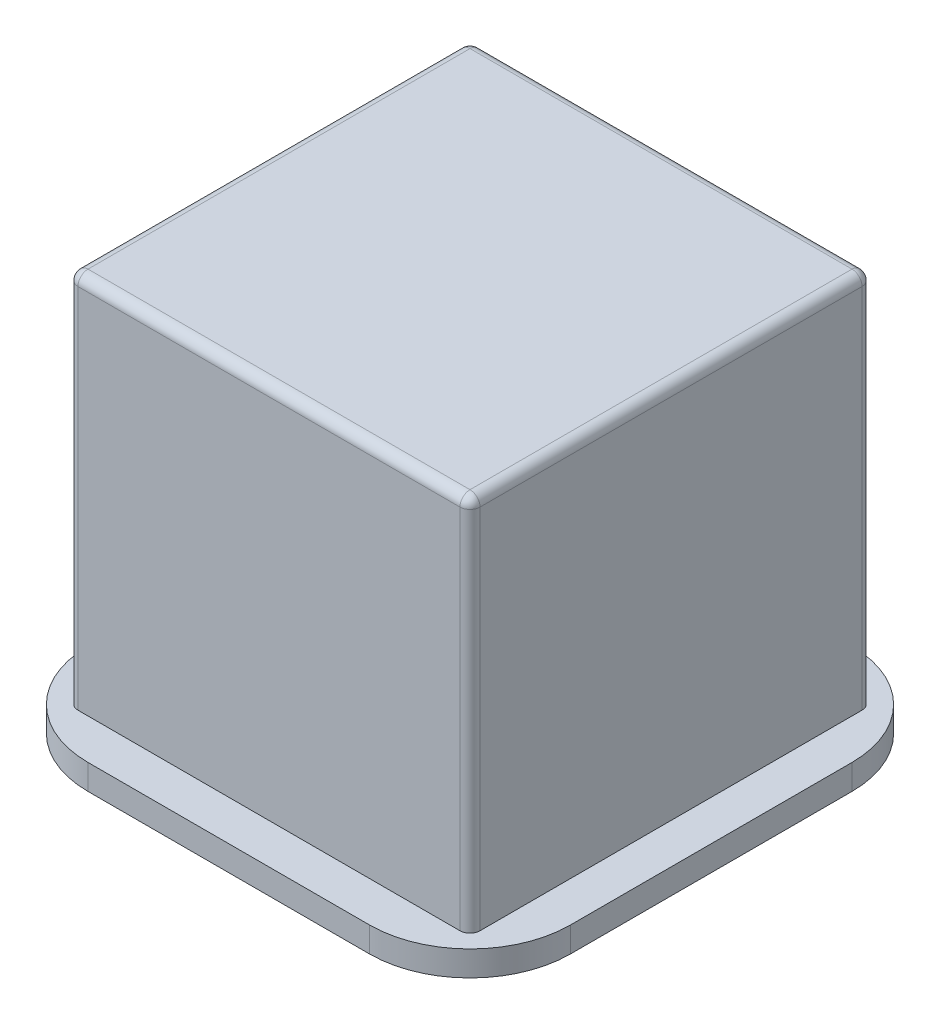
from build123d import *

# Parameters (mm, degrees)
SKETCH1_W           = 200
SKETCH1_H           = 200
BOSS_EXTRUDE1_DEPTH = 200
SKETCH3_W           = 200
SKETCH3_H           = 12.5
BOSS_EXTRUDE2_DEPTH = 20
SKETCH4_W           = 220
SKETCH4_H           = 12.5
BOSS_EXTRUDE3_DEPTH = 20
SKETCH5_W           = 220
SKETCH5_H           = 12.5
BOSS_EXTRUDE4_DEPTH = 20
SKETCH6_W           = 240
SKETCH6_H           = 12.5
BOSS_EXTRUDE5_DEPTH = 20
FILLET1_R           = 50
FILLET2_R           = 5


with BuildPart() as part:
    # Sketch1 → Boss-Extrude1 (new body)
    with BuildSketch(Plane(origin=(0, 0, 0), x_dir=(1, 0, 0), z_dir=(0, 1, 0))):
        with Locations((100, 100)):
            Rectangle(SKETCH1_W, SKETCH1_H)
    extrude(amount=BOSS_EXTRUDE1_DEPTH)

    # Sketch3 → Boss-Extrude2 (add)
    with BuildSketch(Plane.XY):
        with Locations((100, 6.25)):
            Rectangle(SKETCH3_W, SKETCH3_H)
    extrude(amount=BOSS_EXTRUDE2_DEPTH)

    # Sketch4 → Boss-Extrude3 (add)
    with BuildSketch(Plane(origin=(200, 0, 0), x_dir=(0, 0, -1), z_dir=(1, 0, 0))):
        with Locations((90, 6.25)):
            Rectangle(SKETCH4_W, SKETCH4_H)
    extrude(amount=BOSS_EXTRUDE3_DEPTH)

    # Sketch5 → Boss-Extrude4 (add)
    with BuildSketch(Plane(origin=(0, 0, -200), x_dir=(-1, 0, 0), z_dir=(0, 0, -1))):
        with Locations((-110, 6.25)):
            Rectangle(SKETCH5_W, SKETCH5_H)
    extrude(amount=BOSS_EXTRUDE4_DEPTH)

    # Sketch6 → Boss-Extrude5 (add)
    with BuildSketch(Plane.ZY):
        with Locations((-100, 6.25)):
            Rectangle(SKETCH6_W, SKETCH6_H)
    extrude(amount=BOSS_EXTRUDE5_DEPTH)

    # Fillet1
    fillet1_edges = [part.edges().sort_by_distance(p)[0] for p in [
        (220, 6.25, 20),
        (220, 6.25, -220),
        (-20, 6.25, -220),
        (-20, 6.25, 20),
    ]]
    fillet(fillet1_edges, radius=FILLET1_R)

    # Fillet2
    fillet2_edges = [part.edges().sort_by_distance(p)[0] for p in [
        (200, 200, -100),
        (100, 200, -200),
        (0, 200, -100),
        (100, 200, 0),
        (0, 106.25, -200),
        (200, 106.25, -200),
        (200, 106.25, 0),
        (0, 106.25, 0),
    ]]
    fillet(fillet2_edges, radius=FILLET2_R)


solid = part.part
